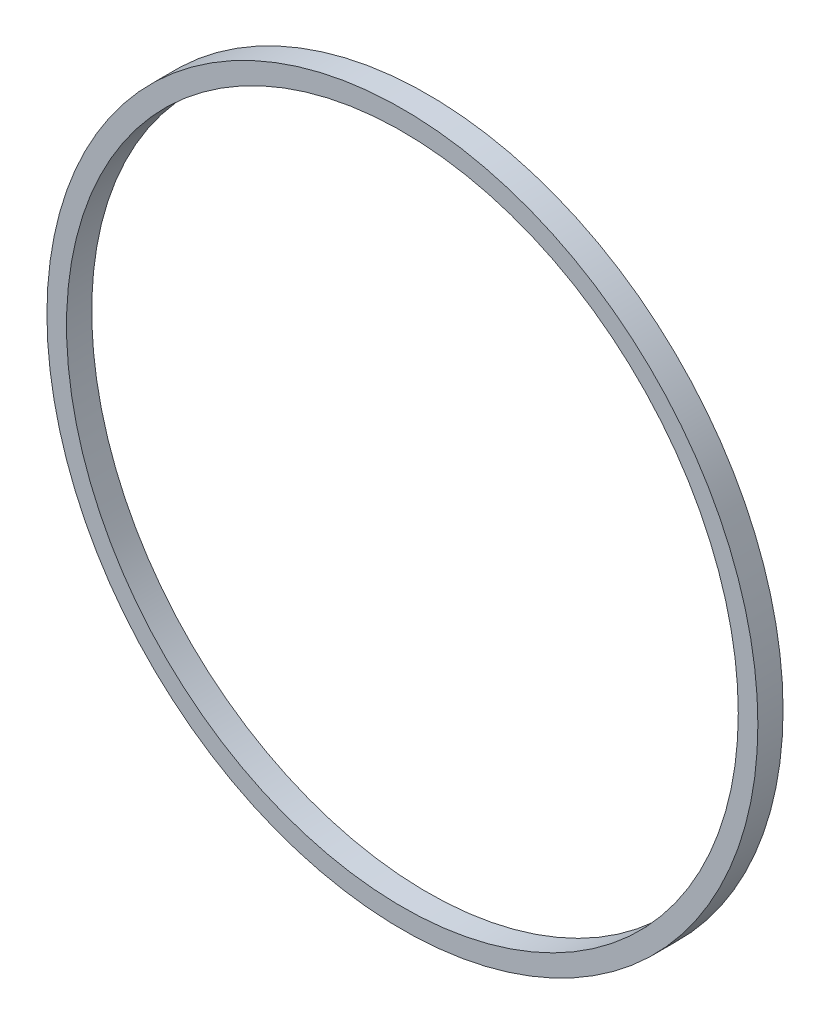
from build123d import *

# Parameters (mm, degrees)
SKETCH1_R           = 63.5
SKETCH1_R_2         = 60
BOSS_EXTRUDE2_DEPTH = 4.5


with BuildPart() as part:
    # Sketch1 → Boss-Extrude2 (new body)
    with BuildSketch(Plane.XY):
        with Locations((70.131179234, 84.268032687)):
            Circle(SKETCH1_R)
        with Locations((70.131179234, 84.268032687)):
            Circle(SKETCH1_R_2, mode=Mode.SUBTRACT)
    extrude(amount=BOSS_EXTRUDE2_DEPTH)


solid = part.part
